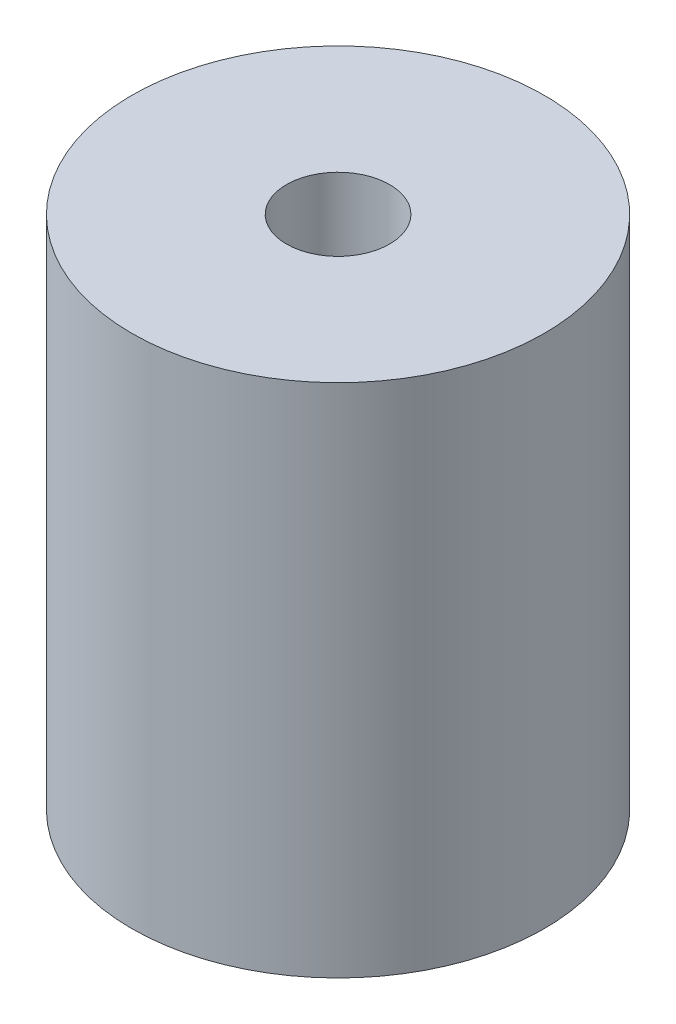
from build123d import *

# Parameters (mm, degrees)
SKETCH_1_R      = 10
SKETCH_1_R_2    = 2.5
EXTRUDE_1_DEPTH = 25


with BuildPart() as part:
    # 草图1 → 凸台-拉伸1 (new body)
    with BuildSketch(Plane(origin=(0, 0, 0), x_dir=(1, 0, 0), z_dir=(0, 1, 0))):
        with Locations(Location((0, 0, 0), (0, 0, 270))):
            Circle(SKETCH_1_R)
        with Locations(Location((0, 0, 0), (0, 0, 270))):
            Circle(SKETCH_1_R_2, mode=Mode.SUBTRACT)
    extrude(amount=EXTRUDE_1_DEPTH)


solid = part.part
